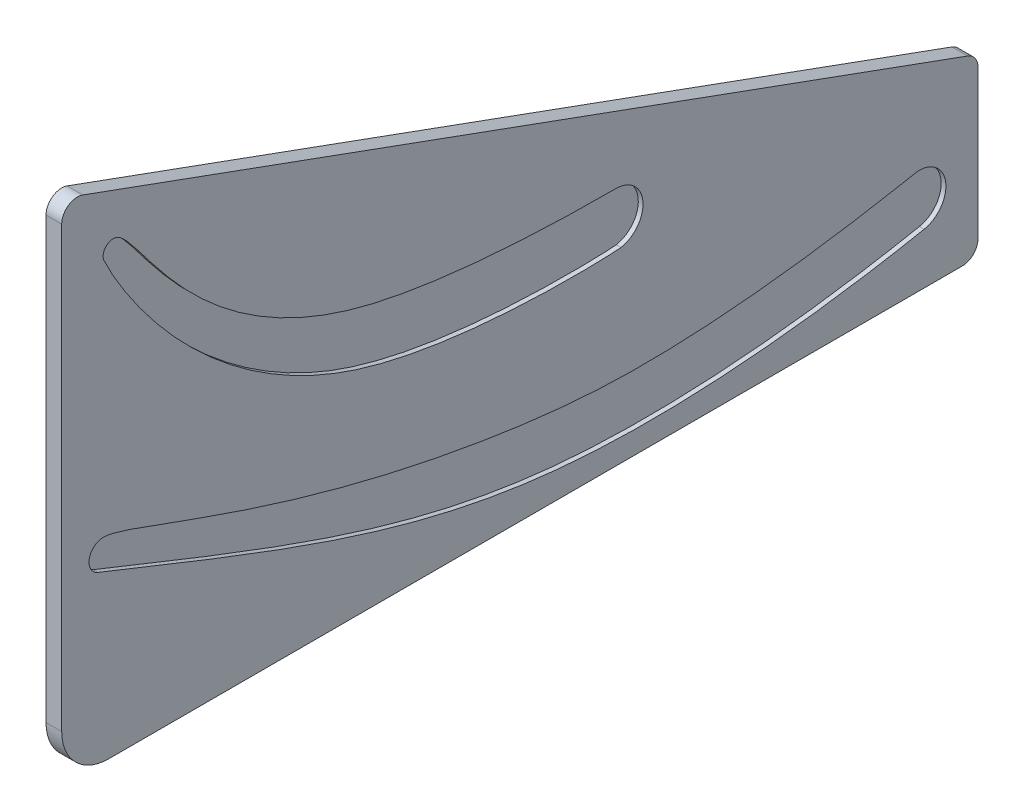
from build123d import *

# Parameters (mm, degrees)
BOSS_EXTRUDE1_DEPTH = 10
CUT_EXTRUDE2_DEPTH  = 3
CUT_EXTRUDE3_DEPTH  = 3


with BuildPart() as part:
    # Sketch1 → Boss-Extrude1 (new body)
    with BuildSketch(Plane(origin=(0, 0, 0), x_dir=(0, 0, -1), z_dir=(1, 0, 0))):
        with BuildLine():
            Line((0, -14.281480067), (0, -294.281480067))
            ThreePointArc((0, -294.281480067), (8.786796564, -315.494683503), (30, -324.281480067))
            Line((30, -324.281480067), (573.815572472, -324.281480067))
            ThreePointArc((573.815572472, -324.281480067), (580.886640283, -321.352547879), (583.815572472, -314.281480067))
            Line((583.815572472, -314.281480067), (583.815572472, -219.493566063))
            ThreePointArc((583.815572472, -219.493566063), (582.007092914, -213.757801699), (577.235773905, -210.096639855))
            Line((577.235773905, -210.096639855), (13.420201433, -4.88455386))
            ThreePointArc((13.420201433, -4.88455386), (4.264235636, -6.089959625), (0, -14.281480067))
        make_face()
    extrude(amount=BOSS_EXTRUDE1_DEPTH)

    # Sketch2 → Cut-Extrude2 (cut)
    with BuildSketch(Plane(origin=(10, 0, 0), x_dir=(0, 0, -1), z_dir=(1, 0, 0))):
        with BuildLine():
            ThreePointArc((23.162175785, -218.017297737), (17.576945532, -207.678107035), (26.738120061, -200.318314743))
            add(Edge.make_bspline(
                [(26.738120061, -200.318314743), (45.914354434, -200.660753587), (151.32107334, -255.510398156), (414.880335601, -286.385074175), (542.431128002, -257.731725159), (546.154906269, -257.731029979)],
                knots=[0, 0, 0, 0, 0.560935224, 0.660935224, 1, 1, 1, 1], degree=3))
            ThreePointArc((546.154906269, -257.731029979), (563.288388976, -273.27487263), (549.474047026, -291.831036849))
            add(Edge.make_bspline(
                [(23.162175785, -218.017297737), (143.080818041, -266.034178467), (284.669923623, -324.572171749), (474.750080899, -306.502271197), (549.474047026, -291.831036849)],
                knots=[0, 0, 0, 0, 0.576111686, 1, 1, 1, 1], degree=3))
        make_face()
        with BuildLine():
            ThreePointArc((26.950185671, -47.737214996), (28.17113687, -40.715672082), (35.124917897, -39.154353359))
            add(Edge.make_bspline(
                [(35.124917897, -39.154353359), (50.602952828, -45.122445935), (99.042539, -170.661871263), (331.224003862, -171.181746235), (353.169530365, -171.181734297)],
                knots=[0, 0, 0, 0, 0.639195597, 1, 1, 1, 1], degree=3))
            ThreePointArc((353.169530365, -171.181734297), (370.309371751, -186.812434708), (356.32010769, -205.316311305))
            add(Edge.make_bspline(
                [(26.950185671, -47.737214996), (35.312726243, -66.629555086), (121.396454164, -217.989087479), (352.838937223, -205.964445921), (356.32010769, -205.316311305)],
                knots=[0, 0, 0, 0, 0.59031533, 1, 1, 1, 1], degree=3))
        make_face()
    extrude(amount=-CUT_EXTRUDE2_DEPTH, mode=Mode.SUBTRACT)

    # Sketch4 → Cut-Extrude3 (cut)
    with BuildSketch(Plane.ZY):
        with BuildLine():
            Line((-561.587294138, -296.630106089), (-27.291979273, -296.630106089))
            ThreePointArc((-27.291979273, -296.630106089), (-18.291979273, -305.630106089), (-27.291979273, -314.630106089))
            Line((-27.291979273, -314.630106089), (-561.587294138, -314.630106089))
            ThreePointArc((-561.587294138, -314.630106089), (-570.587294138, -305.630106089), (-561.587294138, -296.630106089))
        make_face()
    extrude(amount=-CUT_EXTRUDE3_DEPTH, mode=Mode.SUBTRACT)


solid = part.part
